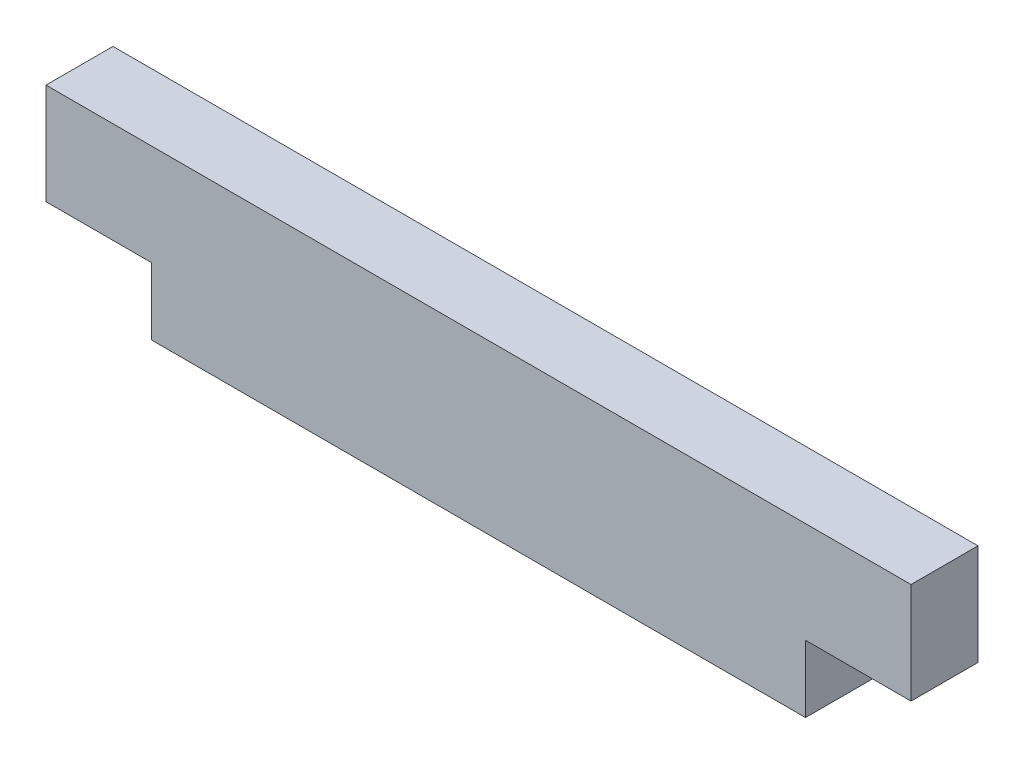
from build123d import *

# Parameters (mm, degrees)
SKETCH1_W           = 41
SKETCH1_H           = 4.788
SKETCH1_W_2         = 12
SKETCH1_H_2         = 3.175
BOSS_EXTRUDE1_DEPTH = 3.175
SKETCH2_W           = 7
SKETCH2_H           = 3.175
BOSS_EXTRUDE3_DEPTH = 3.175


with BuildPart() as part:
    # Sketch1 → Boss-Extrude1 (new body)
    with BuildSketch(Plane.XY):
        Rectangle(SKETCH1_W, SKETCH1_H)
        with Locations((-9.5, -3.9815)):
            Rectangle(SKETCH1_W_2, SKETCH1_H_2)
        with Locations((9.5, -3.9815)):
            Rectangle(SKETCH1_W_2, SKETCH1_H_2)
    extrude(amount=BOSS_EXTRUDE1_DEPTH)

    # Sketch2 → Boss-Extrude3 (add)
    with BuildSketch(Plane.XY.offset(3.175)):
        with Locations((0, -3.9815)):
            Rectangle(SKETCH2_W, SKETCH2_H)
    extrude(amount=-BOSS_EXTRUDE3_DEPTH)


solid = part.part
